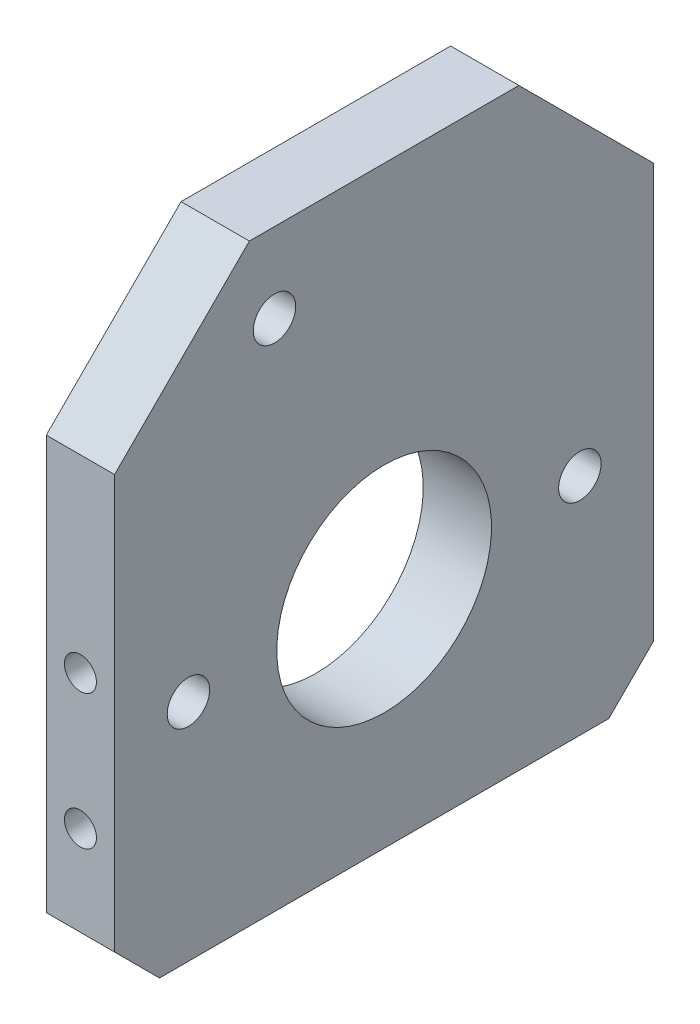
from build123d import *

# Parameters (mm, degrees)
SKETCH1_W                 = 38.1
SKETCH1_H                 = 41.925
SKETCH1_R                 = 7.5875
BOSS_EXTRUDE1_DEPTH       = 4.826
F_3_0_3_DIAMETER_HOLE1_D  = 3
CHAMFER1_SIZE             = 9.525
CHAMFER2_SIZE             = 3.175
F_4_40_TAPPED_HOLE1_D     = 2.2606
F_4_40_TAPPED_HOLE1_DEPTH = 7.62
F_4_40_TAPPED_HOLE1_TIP   = 0.679152758
F_4_40_TAPPED_HOLE2_D     = 2.2606
F_4_40_TAPPED_HOLE2_DEPTH = 7.62
F_4_40_TAPPED_HOLE2_TIP   = 0.679152758


with BuildPart() as part:
    # Sketch1 → Boss-Extrude1 (new body)
    with BuildSketch(Plane(origin=(0, 0, 0), x_dir=(0, 0, -1), z_dir=(1, 0, 0))):
        with Locations((4.25291004, 9.319846416)):
            Rectangle(SKETCH1_W, SKETCH1_H)
        with Locations(Location((4.25291004, 4.232346416, 0), (0, 0, 90))):
            Circle(SKETCH1_R, mode=Mode.SUBTRACT)
    extrude(amount=BOSS_EXTRUDE1_DEPTH)

    # Ø3.0 (3) Diameter Hole1 (through all)
    with Locations(Plane.ZY):
        with Locations((3.49708996, 24.655740175), (9.576406646, 4.232346416), (-18.082226726, 4.232346416)):
            Hole(F_3_0_3_DIAMETER_HOLE1_D / 2)

    # Chamfer1
    chamfer1_edges = [part.edges().sort_by_distance(p)[0] for p in [
        (2.413, 30.282346416, 14.79708996),
        (2.413, 30.282346416, -23.30291004),
    ]]
    chamfer(chamfer1_edges, length=CHAMFER1_SIZE)

    # Chamfer2
    chamfer2_edges = [part.edges().sort_by_distance(p)[0] for p in [
        (2.413, -11.642653584, -23.30291004),
        (2.413, -11.642653584, 14.79708996),
    ]]
    chamfer(chamfer2_edges, length=CHAMFER2_SIZE)

    # #4-40 Tapped Hole1
    with Locations(Plane(origin=(-40.959349893, -24.044697485, -23.30291004), x_dir=(-1, 0, 0), z_dir=(0, 0, -1))):
        with Locations((-43.372349893, 31.452043901), (-43.372349893, 21.927043901)):
            Hole(F_4_40_TAPPED_HOLE1_D / 2, depth=F_4_40_TAPPED_HOLE1_DEPTH)
            with Locations((0, 0, -(F_4_40_TAPPED_HOLE1_DEPTH + F_4_40_TAPPED_HOLE1_TIP / 2))):  # 118° drill point
                Cone(0, F_4_40_TAPPED_HOLE1_D / 2, F_4_40_TAPPED_HOLE1_TIP, mode=Mode.SUBTRACT)

    # #4-40 Tapped Hole2
    with Locations(Plane(origin=(-40.959349893, -24.044697485, 14.79708996), x_dir=(1, 0, 0), z_dir=(0, 0, 1))):
        with Locations((43.372349893, 21.927043901), (43.372349893, 31.452043901)):
            Hole(F_4_40_TAPPED_HOLE2_D / 2, depth=F_4_40_TAPPED_HOLE2_DEPTH)
            with Locations((0, 0, -(F_4_40_TAPPED_HOLE2_DEPTH + F_4_40_TAPPED_HOLE2_TIP / 2))):  # 118° drill point
                Cone(0, F_4_40_TAPPED_HOLE2_D / 2, F_4_40_TAPPED_HOLE2_TIP, mode=Mode.SUBTRACT)


solid = part.part
